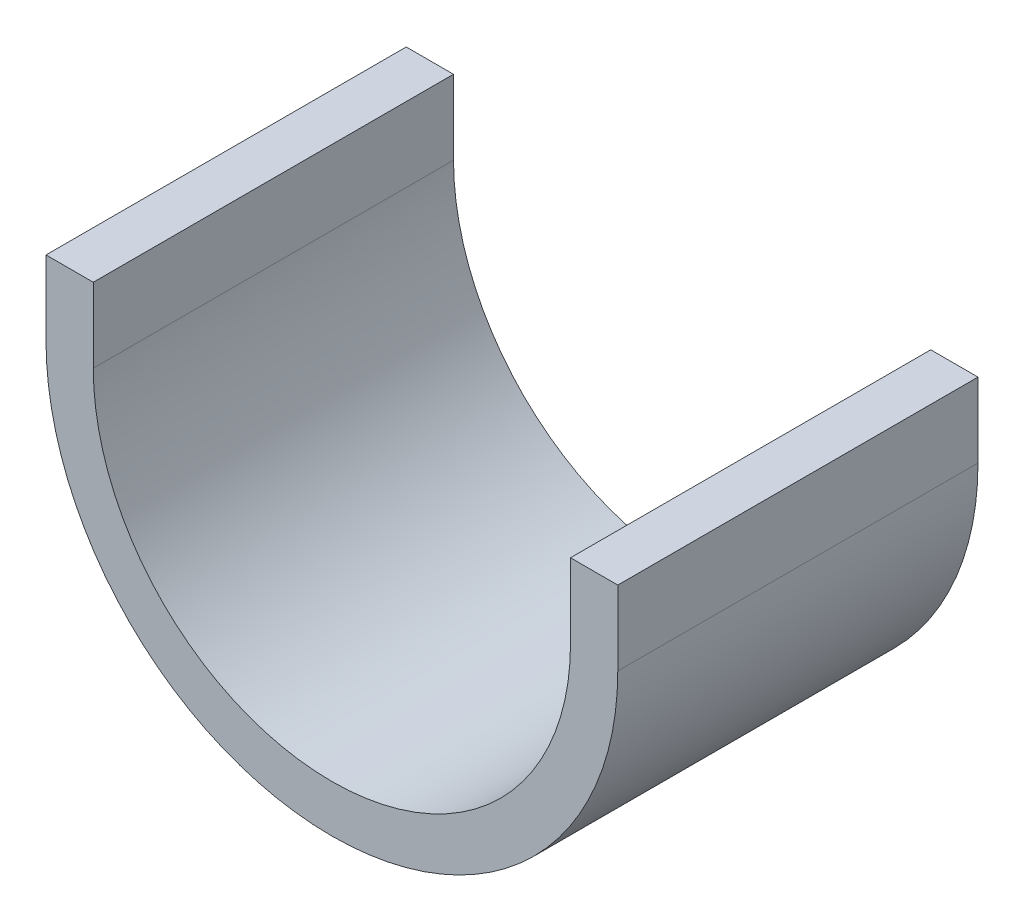
from build123d import *

# Parameters (mm, degrees)
BOSS_EXTRUDE1_DEPTH = 96.774


with BuildPart() as part:
    # Sketch1 → Boss-Extrude1 (new body)
    with BuildSketch(Plane.XY):
        with BuildLine():
            Line((76.805, 20), (76.805, 0))
            ThreePointArc((76.805, 0), (0, -76.805), (-76.805, 0))
            Line((-76.805, 0), (-76.805, 20))
            Line((-76.805, 20), (-64.105, 20))
            Line((-64.105, 20), (-64.105, 0))
            ThreePointArc((-64.105, 0), (0, -64.105), (64.105, 0))
            Line((64.105, 0), (64.105, 20))
            Line((64.105, 20), (76.805, 20))
        make_face()
    extrude(amount=-BOSS_EXTRUDE1_DEPTH)


solid = part.part
